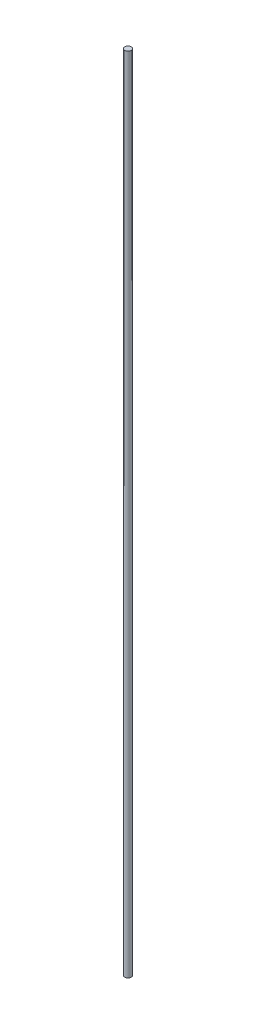
from build123d import *

# Parameters (mm, degrees)
SKETCH1_R           = 4
BOSS_EXTRUDE1_DEPTH = 1000


with BuildPart() as part:
    # Sketch1 → Boss-Extrude1 (new body)
    with BuildSketch(Plane(origin=(0, 0, 0), x_dir=(1, 0, 0), z_dir=(0, 1, 0))):
        with Locations(Location((0, 0, 0), (0, 0, 270))):
            Circle(SKETCH1_R)
    extrude(amount=BOSS_EXTRUDE1_DEPTH)


solid = part.part
